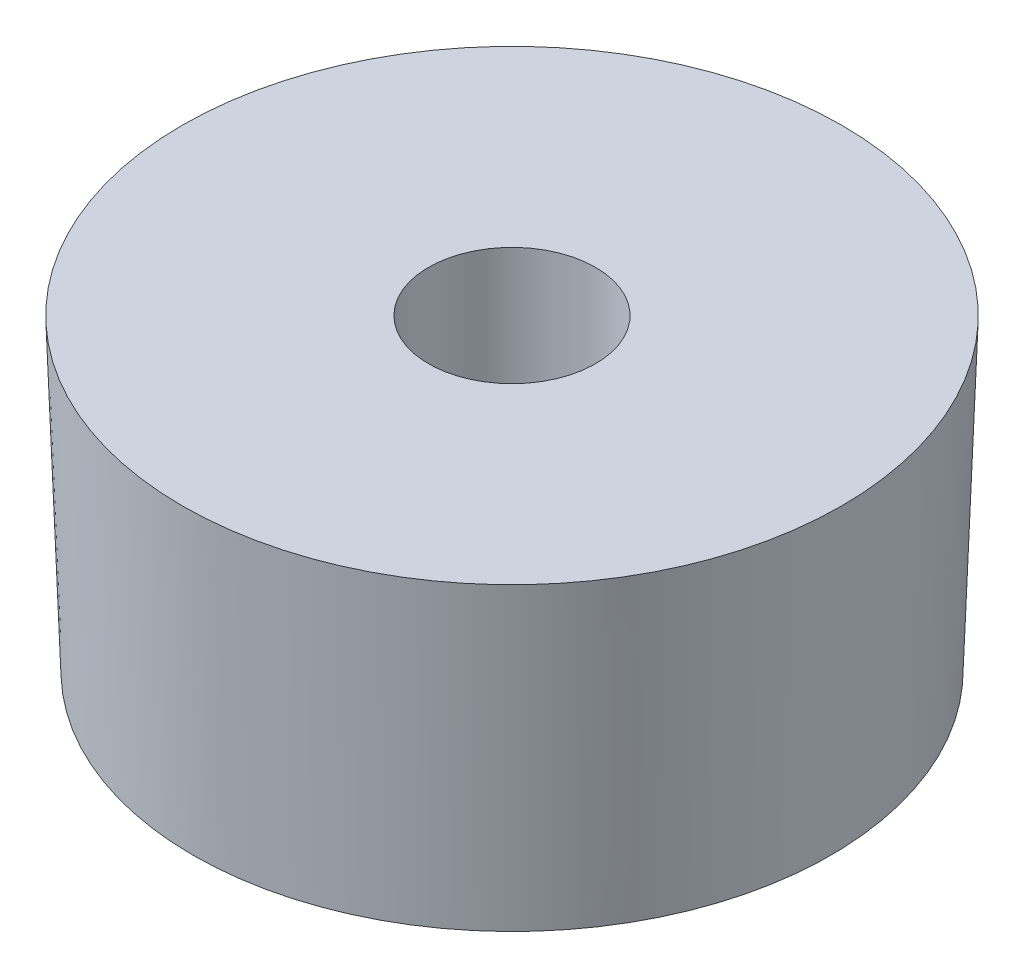
from build123d import *

# Parameters (mm, degrees)
SKETCH1_R                                           = 7.25
BOSS_EXTRUDE2_DEPTH                                 = 7
BOSS_EXTRUDE2_DRAFT                                 = -2
CBORE_FOR_6_BINDING_HEAD_MACHINE_SCREW1_D           = 3.7973
CBORE_FOR_6_BINDING_HEAD_MACHINE_SCREW1_CBORE_D     = 7.9375
CBORE_FOR_6_BINDING_HEAD_MACHINE_SCREW1_CBORE_DEPTH = 2.2098


with BuildPart() as part:
    # Sketch1 → Boss-Extrude2 (with draft: the straight prism first)
    with BuildSketch(Plane(origin=(0, 0, 0), x_dir=(1, 0, 0), z_dir=(0, 1, 0))):
        Circle(SKETCH1_R)
    extrude(amount=BOSS_EXTRUDE2_DEPTH)
    # Boss-Extrude2: the draft: its side faces are tilted about the plane it starts from
    boss_extrude2_sides = [part.faces().sort_by_distance(p)[0] for p in [
        (-7.25, 3.5, 0),
    ]]
    draft(boss_extrude2_sides, Plane(origin=(0, 0, 0), x_dir=(1, 0, 0), z_dir=(0, 1, 0)), BOSS_EXTRUDE2_DRAFT)

    # CBORE for #6 Binding Head Machine Screw1 (through all)
    with Locations(Plane(origin=(0, 0, 0), x_dir=(-1, 0, 0), z_dir=(0, -1, 0))):
        with Locations((0, 0)):
            CounterBoreHole(CBORE_FOR_6_BINDING_HEAD_MACHINE_SCREW1_D / 2, CBORE_FOR_6_BINDING_HEAD_MACHINE_SCREW1_CBORE_D / 2, CBORE_FOR_6_BINDING_HEAD_MACHINE_SCREW1_CBORE_DEPTH)


solid = part.part
